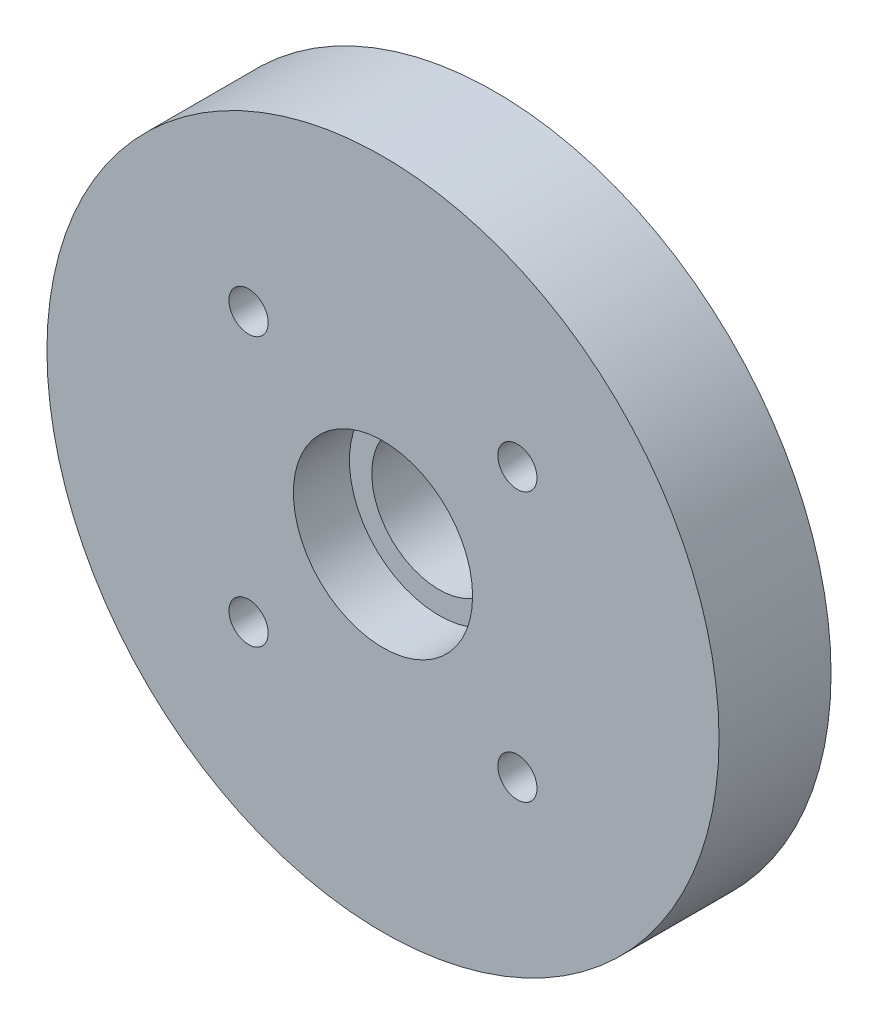
from build123d import *

# Parameters (mm, degrees)
SKETCH1_R           = 30
SKETCH1_R_2         = 6
BOSS_EXTRUDE1_DEPTH = 10
SKETCH2_R           = 8
CUT_EXTRUDE1_DEPTH  = 5
SKETCH3_R           = 1.75
CUT_EXTRUDE2_DEPTH  = 44.588989435


with BuildPart() as part:
    # Sketch1 → Boss-Extrude1 (new body)
    with BuildSketch(Plane.XY):
        Circle(SKETCH1_R)
        Circle(SKETCH1_R_2, mode=Mode.SUBTRACT)
    extrude(amount=BOSS_EXTRUDE1_DEPTH)

    # Sketch2 → Cut-Extrude1 (cut)
    with BuildSketch(Plane.XY.offset(10)):
        Circle(SKETCH2_R)
    extrude(amount=-CUT_EXTRUDE1_DEPTH, mode=Mode.SUBTRACT)

    # Sketch3 → Cut-Extrude2 (cut, through all)
    with BuildSketch(Plane.XY.offset(10)):
        with Locations((-12, 12)):
            Circle(SKETCH3_R)
        with Locations(Location((12, 12, 0), (0, 0, 180))):
            Circle(SKETCH3_R)
        with Locations((12, -12)):
            Circle(SKETCH3_R)
        with Locations(Location((-12, -12, 0), (0, 0, 180))):
            Circle(SKETCH3_R)
    extrude(amount=-CUT_EXTRUDE2_DEPTH, mode=Mode.SUBTRACT)


solid = part.part
